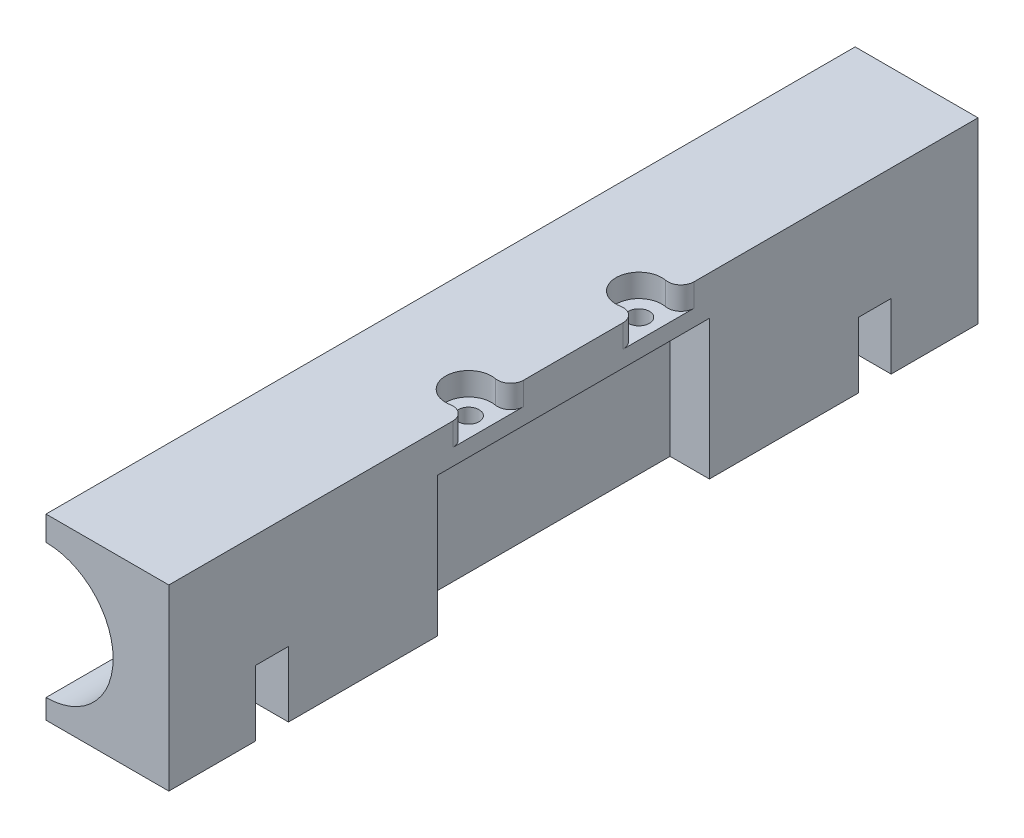
from build123d import *

# Parameters (mm, degrees)
SKETCH_1_W          = 6
SKETCH_1_H          = 41.5
SKETCH_1_R          = 1.6
EXTRUDE_1_DEPTH     = 3
EXTRUDE_2_DEPTH     = 41.5
EXTRUDE_START       = 17
EXTRUDE_3_DEPTH     = 17
EXTRUDE_START_2     = 10
EXTRUDE_4_DEPTH     = 10
SKETCH_6_W          = 18.75
SKETCH_6_H          = 95.5
SKETCH_6_R          = 1.6
EXTRUDE_5_DEPTH     = 3
EXTRUDE_START_3     = 75.5
EXTRUDE_6_DEPTH     = 75.5
SKETCH_8_W          = 6
SKETCH_8_H          = 41.5
CUT_EXTRUDE_1_DEPTH = 53.193150892
SKETCH_9_R          = 3.5
CUT_EXTRUDE_2_DEPTH = 3.5
FILLET_1_R          = 2
EXTRUDE_START_4     = 14
EXTRUDE_7_DEPTH     = 14
EXTRUDE_8_DEPTH     = 14
SKETCH_12_W         = 5
SKETCH_12_H         = 10
CUT_EXTRUDE_3_DEPTH = 68.942530862


with BuildPart() as part:
    # 草图1 → 凸台-拉伸1 (new body)
    with BuildSketch(Plane(origin=(0, 0, 0), x_dir=(1, 0, 0), z_dir=(0, 1, 0))):
        Rectangle(SKETCH_1_W, SKETCH_1_H)
        with Locations(Location((0, 13, 0), (0, 0, 270))):
            Circle(SKETCH_1_R, mode=Mode.SUBTRACT)
        with Locations(Location((0, -13, 0), (0, 0, 270))):
            Circle(SKETCH_1_R, mode=Mode.SUBTRACT)
    extrude(amount=EXTRUDE_1_DEPTH)

    # 草图2 → 凸台-拉伸2 (add)
    with BuildSketch(Plane.XY.offset(20.75)):
        with BuildLine():
            ThreePointArc((-5.5, -8), (-8.502155493, -0.752155493), (-15.75, 2.25))
            Line((-15.75, 2.25), (-15.75, 3))
            Line((-15.75, 3), (-5.5, 3))
            Line((-5.5, 3), (-5.5, -8))
        make_face()
        Polygon((-5.5, 3), (-5.5, -8), (-3, -8), (-3, 0), (-3, 3), align=None)
    extrude(amount=-EXTRUDE_2_DEPTH)

    # 草图4 → 凸台-拉伸3 (add)
    with BuildSketch(Plane.XY.offset(20.75).offset(EXTRUDE_START)):
        with BuildLine():
            Line((3, -8), (3, 3))
            Line((3, 3), (-15.75, 3))
            Line((-15.75, 3), (-15.75, 2.25))
            ThreePointArc((-15.75, 2.25), (-8.502155493, -0.752155493), (-5.5, -8))
            Line((-5.5, -8), (3, -8))
        make_face()
    extrude_3 = extrude(amount=-EXTRUDE_3_DEPTH)

    # 草图5 → 凸台-拉伸4 (add)
    with BuildSketch(Plane.XY.offset(37.75).offset(EXTRUDE_START_2)):
        with BuildLine():
            Line((-15.75, -18.25), (-15.75, -21.25))
            Line((-15.75, -21.25), (3, -21.25))
            Line((3, -21.25), (3, 3))
            Line((3, 3), (-15.75, 3))
            Line((-15.75, 3), (-15.75, 2.25))
            ThreePointArc((-15.75, 2.25), (-5.5, -8), (-15.75, -18.25))
        make_face()
    extrude_4 = extrude(amount=-EXTRUDE_4_DEPTH)

    # 镜向1: 凸台-拉伸3, 凸台-拉伸4 across plane
    add(extrude_3.mirror(Plane.XY))
    add(extrude_4.mirror(Plane.XY))

    # 草图6 → 凸台-拉伸5 (add)
    with BuildSketch(Plane(origin=(0, 3, 0), x_dir=(1, 0, 0), z_dir=(0, 1, 0))):
        with Locations((-6.375, 0)):
            Rectangle(SKETCH_6_W, SKETCH_6_H)
        with Locations(Location((0, -13, 0), (0, 0, 270))):
            Circle(SKETCH_6_R, mode=Mode.SUBTRACT)
        with Locations(Location((0, 13, 0), (0, 0, 270))):
            Circle(SKETCH_6_R, mode=Mode.SUBTRACT)
    extrude(amount=EXTRUDE_5_DEPTH)

    # 草图7 → 凸台-拉伸6 (add)
    with BuildSketch(Plane.XY.offset(-37.75).offset(EXTRUDE_START_3)):
        with BuildLine():
            Line((3, -8), (-5.5, -8))
            ThreePointArc((-5.5, -8), (-8.502155493, -15.247844507), (-15.75, -18.25))
            Line((-15.75, -18.25), (-15.75, -21.25))
            Line((-15.75, -21.25), (3, -21.25))
            Line((3, -21.25), (3, -8))
        make_face()
    extrude(amount=-EXTRUDE_6_DEPTH)

    # 草图8 → 切除-拉伸1 (cut, through all)
    with BuildSketch(Plane(origin=(0, -8, 0), x_dir=(1, 0, 0), z_dir=(0, 1, 0))):
        Rectangle(SKETCH_8_W, SKETCH_8_H)
    extrude(amount=-CUT_EXTRUDE_1_DEPTH, mode=Mode.SUBTRACT)

    # 草图9 → 切除-拉伸2 (cut)
    with BuildSketch(Plane(origin=(0, 6, 0), x_dir=(1, 0, 0), z_dir=(0, 1, 0))):
        with Locations((0, 13)):
            Circle(SKETCH_9_R)
        with Locations((0, -13)):
            Circle(SKETCH_9_R)
    extrude(amount=-CUT_EXTRUDE_2_DEPTH, mode=Mode.SUBTRACT)

    # 圆角1
    fillet_1_edges = [part.edges().sort_by_distance(p)[0] for p in [
        (3, 4.25, -11.197224362),
        (3, 4.25, -14.802775638),
        (3, 4.25, 14.802775638),
        (3, 4.25, 11.197224362),
    ]]
    fillet(fillet_1_edges, radius=FILLET_1_R)

    # 草图10 → 凸台-拉伸7 (add)
    with BuildSketch(Plane.XY.offset(47.75).offset(EXTRUDE_START_4)):
        with BuildLine():
            Line((-15.75, -18.25), (-15.75, -21.25))
            Line((-15.75, -21.25), (3, -21.25))
            Line((3, -21.25), (3, 6))
            Line((3, 6), (-15.75, 6))
            Line((-15.75, 6), (-15.75, 2.25))
            ThreePointArc((-15.75, 2.25), (-5.5, -8), (-15.75, -18.25))
        make_face()
    extrude(amount=-EXTRUDE_7_DEPTH)

    # 草图11 → 凸台-拉伸8 (add)
    with BuildSketch(Plane(origin=(0, 0, -47.75), x_dir=(-1, 0, 0), z_dir=(0, 0, -1))):
        with BuildLine():
            Line((15.75, 2.25), (15.75, 6))
            Line((15.75, 6), (-3, 6))
            Line((-3, 6), (-3, -21.25))
            Line((-3, -21.25), (15.75, -21.25))
            Line((15.75, -21.25), (15.75, -18.25))
            ThreePointArc((15.75, -18.25), (5.5, -8), (15.75, 2.25))
        make_face()
    extrude(amount=EXTRUDE_8_DEPTH)

    # 草图12 → 切除-拉伸3 (cut, through all)
    with BuildSketch(Plane(origin=(3, 0, 0), x_dir=(0, 0, -1), z_dir=(1, 0, 0))):
        with Locations((45.99, -16.25)):
            Rectangle(SKETCH_12_W, SKETCH_12_H)
        with Locations((-45.99, -16.25)):
            Rectangle(SKETCH_12_W, SKETCH_12_H)
    extrude(amount=-CUT_EXTRUDE_3_DEPTH, mode=Mode.SUBTRACT)


solid = part.part
